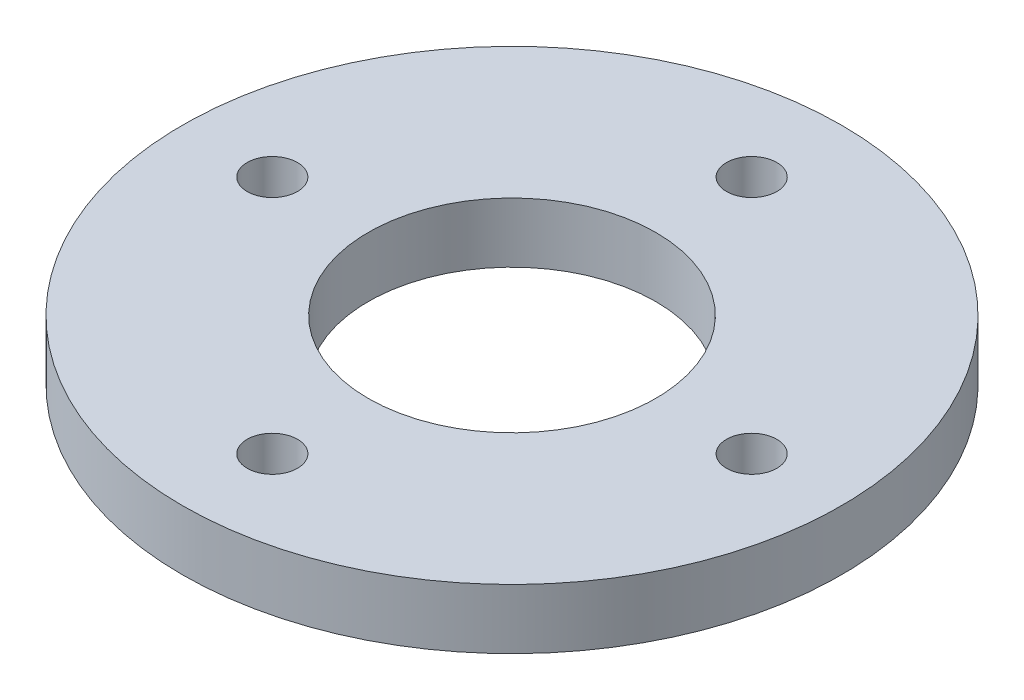
from build123d import *

# Parameters (mm, degrees)
SKETCH1_R           = 27.5
SKETCH1_R_2         = 12
BOSS_EXTRUDE1_DEPTH = 5
SKETCH2_R           = 2.1
CUT_EXTRUDE1_DEPTH  = 5


with BuildPart() as part:
    # Sketch1 → Boss-Extrude1 (new body)
    with BuildSketch(Plane(origin=(0, 0, 0), x_dir=(1, 0, 0), z_dir=(0, 1, 0))):
        with Locations(Location((0, 0, 0), (0, 0, 270))):
            Circle(SKETCH1_R)
        with Locations(Location((0, 0, 0), (0, 0, 270))):
            Circle(SKETCH1_R_2, mode=Mode.SUBTRACT)
    extrude(amount=BOSS_EXTRUDE1_DEPTH)

    # Sketch2 → Cut-Extrude1 (cut)
    with BuildSketch(Plane(origin=(0, 5, 0), x_dir=(1, 0, 0), z_dir=(0, 1, 0))):
        with Locations(Location((0, 20, 0), (0, 0, 270))):
            Circle(SKETCH2_R)
        with Locations(Location((0, -20, 0), (0, 0, 270))):
            Circle(SKETCH2_R)
        with Locations(Location((20, 0, 0), (0, 0, 270))):
            Circle(SKETCH2_R)
        with Locations(Location((-20, 0, 0), (0, 0, 270))):
            Circle(SKETCH2_R)
    extrude(amount=-CUT_EXTRUDE1_DEPTH, mode=Mode.SUBTRACT)


solid = part.part
